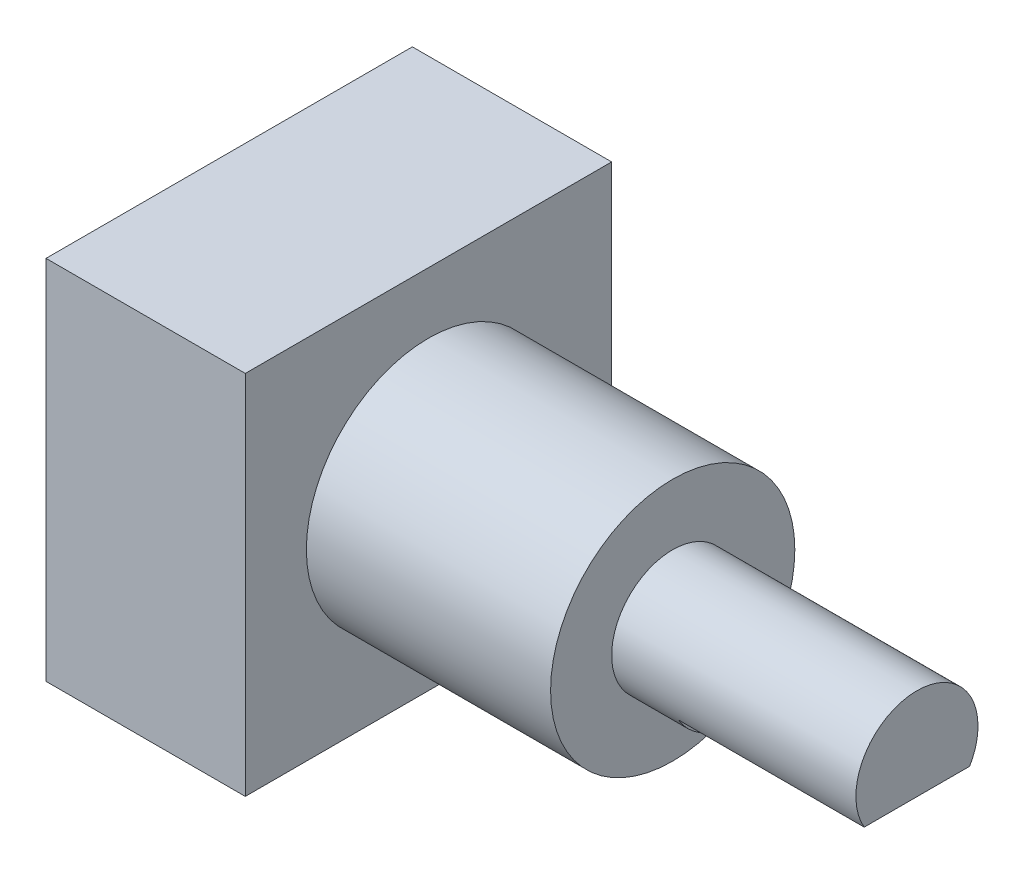
from build123d import *

# Parameters (mm, degrees)
SKETCH2_W           = 9.525
SKETCH2_H           = 9.525
BOSS_EXTRUDE1_DEPTH = 5.1816
CUT_EXTRUDE1_DEPTH  = 4.826


with BuildPart() as part:
    # Sketch1 → Revolve1 (revolve)
    with BuildSketch(Plane.XY, mode=Mode.PRIVATE) as revolve1_sk:
        Polygon((0, 3.175), (6.35, 3.175), (6.35, 1.5875), (12.7, 1.5875), (12.7, 0), (0, 0), align=None)
    revolve(revolve1_sk.sketch.rotate(Axis((0, 0, 0), (-1, 0, 0)), 90), axis=Axis((0, 0, 0), (-1, 0, 0)))

    # Sketch2 → Boss-Extrude1 (add)
    with BuildSketch(Plane(origin=(0, 0, 0), x_dir=(0, 0, -1), z_dir=(1, 0, 0))):
        Rectangle(SKETCH2_W, SKETCH2_H)
    extrude(amount=-BOSS_EXTRUDE1_DEPTH)

    # Sketch4 → Cut-Extrude1 (cut)
    with BuildSketch(Plane(origin=(12.7, 0, 0), x_dir=(0, 0, -1), z_dir=(1, 0, 0))):
        with BuildLine():
            Line((-1.371129549, -0.8001), (1.371129549, -0.8001))
            ThreePointArc((1.371129549, -0.8001), (0, -1.5875), (-1.371129549, -0.8001))
        make_face()
    extrude(amount=-CUT_EXTRUDE1_DEPTH, mode=Mode.SUBTRACT)


solid = part.part
